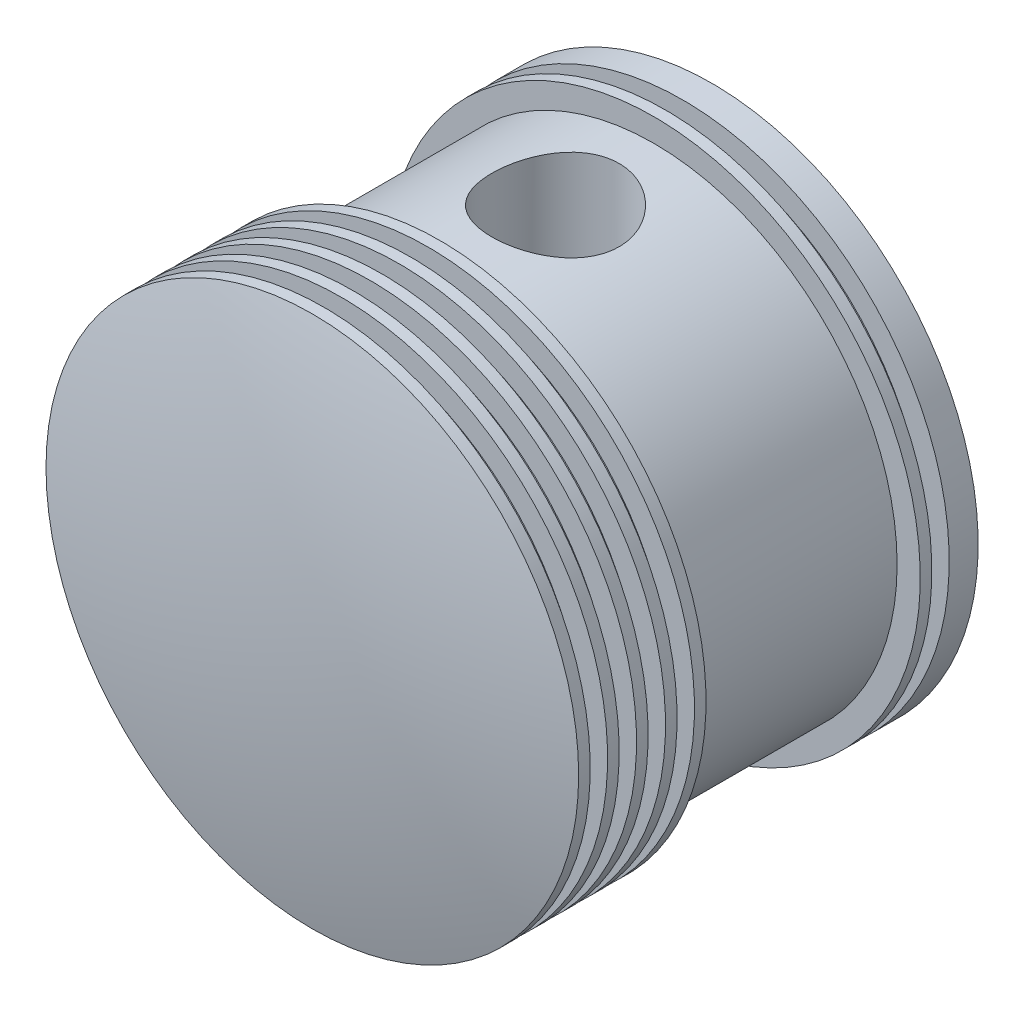
from build123d import *

# Parameters (mm, degrees)
SKETCH1_W               = 4
SKETCH1_H               = 2
SKETCH1_H_2             = 5
CUT_EXTRUDE1_DEPTH      = 94.386294498
CUT_EXTRUDE1_DEPTH_BACK = 94.386294498
SKETCH2_R               = 11


with BuildPart() as part:
    # Sketch1 → Revolve1 (revolve)
    with BuildSketch(Plane.YZ, mode=Mode.PRIVATE) as revolve1_sk:
        with BuildLine():
            ThreePointArc((-46, 2), (-23.174880185, 6.257119382), (0, 7.683334091))
            Line((0, 7.683334091), (0, 2))
            Line((0, 2), (-46, 2))
        make_face()
        Polygon((-46, 2), (-46, 0), (-42, 0), (0, 0), (0, 2), align=None)
        Polygon((0, 0), (-42, 0), (-42, -3), (-42, -5), (-42, -8), (-42, -10), (-42, -13), (-42, -15), (-42, -18), (-42, -20), (-42, -57), (-42, -59), (-42, -62), (-42, -67), (-37, -67), (-37, -58), (-25, -58), (-25, -22), (-37, -22), (-37, -5), (0, -5), align=None)
        with Locations((-44, -4)):
            Rectangle(SKETCH1_W, SKETCH1_H)
        with Locations((-44, -9)):
            Rectangle(SKETCH1_W, SKETCH1_H)
        with Locations((-44, -19)):
            Rectangle(SKETCH1_W, SKETCH1_H)
        with Locations((-44, -14)):
            Rectangle(SKETCH1_W, SKETCH1_H)
        with Locations((-44, -58)):
            Rectangle(SKETCH1_W, SKETCH1_H)
        with Locations((-44, -64.5)):
            Rectangle(SKETCH1_W, SKETCH1_H_2)
    revolve(revolve1_sk.sketch.rotate(Axis((0, 0, 0), (0, 0, 1)), 270), axis=Axis((0, 0, 0), (0, 0, 1)))

    # Sketch2 → Cut-Extrude1 (cut, two sides: drawn at the far end of the back side and taken through both)
    with BuildSketch(Plane(origin=(0, 0, 0), x_dir=(-1, 0, 0), z_dir=(0, 1, 0)).offset(-CUT_EXTRUDE1_DEPTH_BACK)):
        with Locations(Location((0, -40, 0), (0, 0, 90))):
            Circle(SKETCH2_R)
    extrude(amount=CUT_EXTRUDE1_DEPTH + CUT_EXTRUDE1_DEPTH_BACK, mode=Mode.SUBTRACT)


solid = part.part
